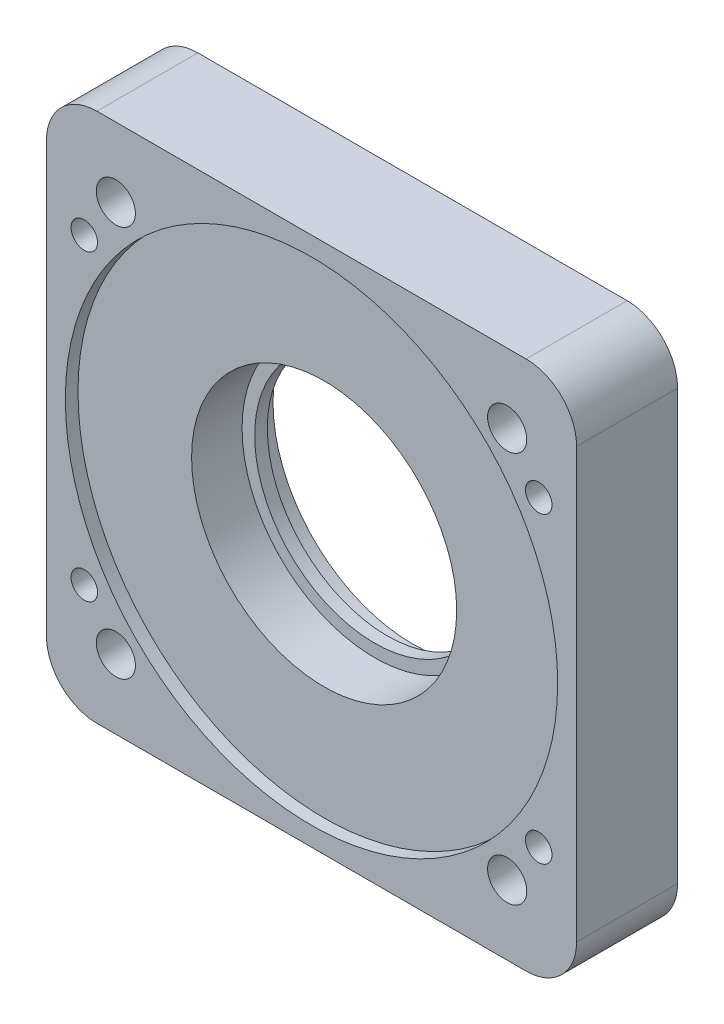
from build123d import *

# Parameters (mm, degrees)
SKETCH_1_W          = 42
SKETCH_1_H          = 42
EXTRUDE_1_DEPTH     = 8
SKETCH_2_R          = 9.5
CUT_EXTRUDE_1_DEPTH = 31.757112998
SKETCH_3_R          = 10.5
CUT_EXTRUDE_2_DEPTH = 5
SKETCH_6_R          = 11.05
CUT_EXTRUDE_3_DEPTH = 2
FILLET_1_R          = 4
SKETCH_8_R          = 19.5
CUT_EXTRUDE_4_DEPTH = 1
SKETCH_9_R          = 1.55
CUT_EXTRUDE_5_DEPTH = 31.757112998
SKETCH_10_R         = 1.55
CUT_EXTRUDE_6_DEPTH = 31.757112998
EXTRUDE_START       = -2
SKETCH_11_R         = 1.55
SKETCH_11_R_2       = 1.05
EXTRUDE_3_DEPTH     = 2


with BuildPart() as part:
    # 草图1 → 凸台-拉伸1 (new body)
    with BuildSketch(Plane.XY):
        Rectangle(SKETCH_1_W, SKETCH_1_H)
    extrude(amount=EXTRUDE_1_DEPTH)

    # 草图2 → 切除-拉伸1 (cut, through all)
    with BuildSketch(Plane.XY.offset(8)):
        Circle(SKETCH_2_R)
    extrude(amount=-CUT_EXTRUDE_1_DEPTH, mode=Mode.SUBTRACT)

    # 草图3 → 切除-拉伸2 (cut)
    with BuildSketch(Plane.XY.offset(8)):
        Circle(SKETCH_3_R)
    extrude(amount=-CUT_EXTRUDE_2_DEPTH, mode=Mode.SUBTRACT)

    # 草图6 → 切除-拉伸3 (cut)
    with BuildSketch(Plane(origin=(0, 0, 0), x_dir=(-1, 0, 0), z_dir=(0, 0, -1))):
        Circle(SKETCH_6_R)
    extrude(amount=-CUT_EXTRUDE_3_DEPTH, mode=Mode.SUBTRACT)

    # 圆角1
    fillet_1_edges = [part.edges().sort_by_distance(p)[0] for p in [
        (21, -21, 4),
        (-21, -21, 4),
        (-21, 21, 4),
        (21, 21, 4),
    ]]
    fillet(fillet_1_edges, radius=FILLET_1_R)

    # 草图8 → 切除-拉伸4 (cut)
    with BuildSketch(Plane.XY.offset(8)):
        Circle(SKETCH_8_R)
    extrude(amount=-CUT_EXTRUDE_4_DEPTH, mode=Mode.SUBTRACT)

    # 草图9 → 切除-拉伸5 (cut, through all)
    with BuildSketch(Plane(origin=(0, 0, 0), x_dir=(-1, 0, 0), z_dir=(0, 0, -1))):
        with Locations((-15.5, 15.5)):
            Circle(SKETCH_9_R)
        with Locations((15.5, 15.5)):
            Circle(SKETCH_9_R)
        with Locations((15.5, -15.5)):
            Circle(SKETCH_9_R)
        with Locations((-15.5, -15.5)):
            Circle(SKETCH_9_R)
    extrude(amount=-CUT_EXTRUDE_5_DEPTH, mode=Mode.SUBTRACT)

    # 草图10 → 切除-拉伸6 (cut, through all)
    with BuildSketch(Plane(origin=(0, 0, 0), x_dir=(-1, 0, 0), z_dir=(0, 0, -1))):
        with Locations((-18, 12)):
            Circle(SKETCH_10_R)
        with Locations(Location((18, 12, 0), (0, 0, 180))):
            Circle(SKETCH_10_R)
        with Locations((18, -12)):
            Circle(SKETCH_10_R)
        with Locations(Location((-18, -12, 0), (0, 0, 180))):
            Circle(SKETCH_10_R)
    extrude(amount=-CUT_EXTRUDE_6_DEPTH, mode=Mode.SUBTRACT)

    # 草图11 → 凸台-拉伸3 (add)
    # profile 1 of 4: a face of its own
    with BuildSketch(Plane.XY.offset(8).offset(EXTRUDE_START)):
        with Locations((-18, 12)):
            Circle(SKETCH_11_R)
        with Locations((-18, 12)):
            Circle(SKETCH_11_R_2, mode=Mode.SUBTRACT)
    # profile 2 of 4: a face of its own
    with BuildSketch(Plane.XY.offset(8).offset(EXTRUDE_START)):
        with Locations(Location((18, 12, 0), (0, 0, 180))):
            Circle(SKETCH_11_R)
        with Locations(Location((18, 12, 0), (0, 0, 180))):
            Circle(SKETCH_11_R_2, mode=Mode.SUBTRACT)
    # profile 3 of 4: a face of its own
    with BuildSketch(Plane.XY.offset(8).offset(EXTRUDE_START)):
        with Locations((18, -12)):
            Circle(SKETCH_11_R)
        with Locations((18, -12)):
            Circle(SKETCH_11_R_2, mode=Mode.SUBTRACT)
    # profile 4 of 4: a face of its own
    with BuildSketch(Plane.XY.offset(8).offset(EXTRUDE_START)):
        with Locations(Location((-18, -12, 0), (0, 0, 180))):
            Circle(SKETCH_11_R)
        with Locations(Location((-18, -12, 0), (0, 0, 180))):
            Circle(SKETCH_11_R_2, mode=Mode.SUBTRACT)
    extrude(amount=EXTRUDE_3_DEPTH)


solid = part.part
